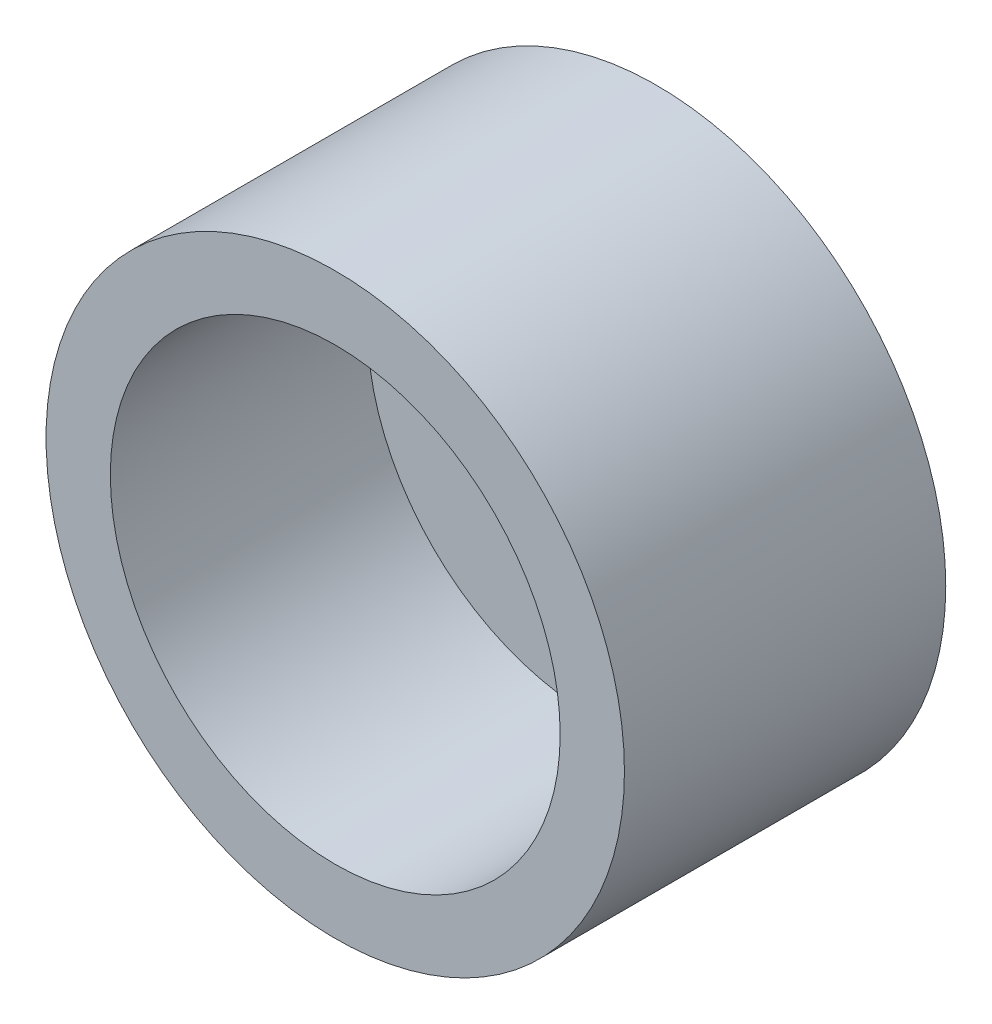
from build123d import *

# Parameters (mm, degrees)
CROQUIS1_R              = 9
SALIENTE_EXTRUIR1_DEPTH = 10
VACIADO1_T              = -2


with BuildPart() as part:
    # Croquis1 → Saliente-Extruir1 (new body)
    with BuildSketch(Plane.XY):
        Circle(CROQUIS1_R)
    extrude(amount=SALIENTE_EXTRUIR1_DEPTH)

    # Vaciado1
    vaciado1_openings = [part.faces().sort_by_distance(p)[0] for p in [
        (0, 0, 10),
    ]]
    offset(amount=VACIADO1_T, openings=vaciado1_openings, kind=Kind.INTERSECTION)


solid = part.part
